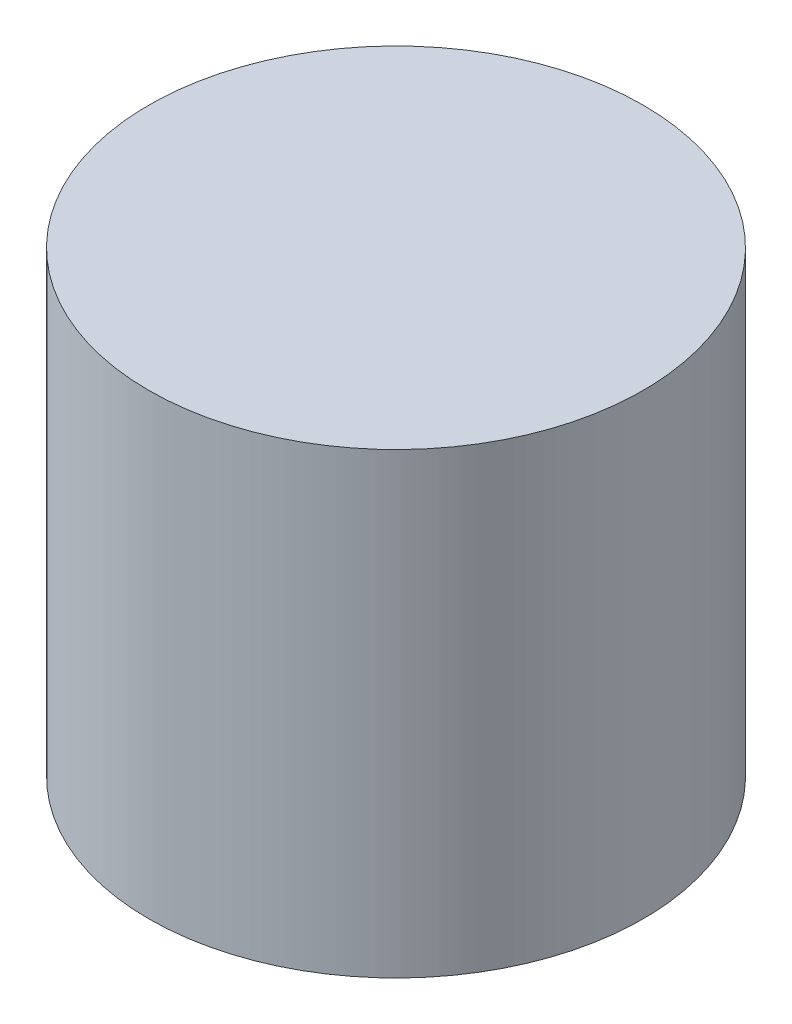
from build123d import *

# Parameters (mm, degrees)
SKETCH1_R           = 27.13
BOSS_EXTRUDE1_DEPTH = 50.24


with BuildPart() as part:
    # Sketch1 → Boss-Extrude1 (new body)
    with BuildSketch(Plane(origin=(0, 0, 0), x_dir=(1, 0, 0), z_dir=(0, 1, 0))):
        with Locations(Location((0, 0, 0), (0, 0, 270))):
            Circle(SKETCH1_R)
    extrude(amount=BOSS_EXTRUDE1_DEPTH)


solid = part.part
